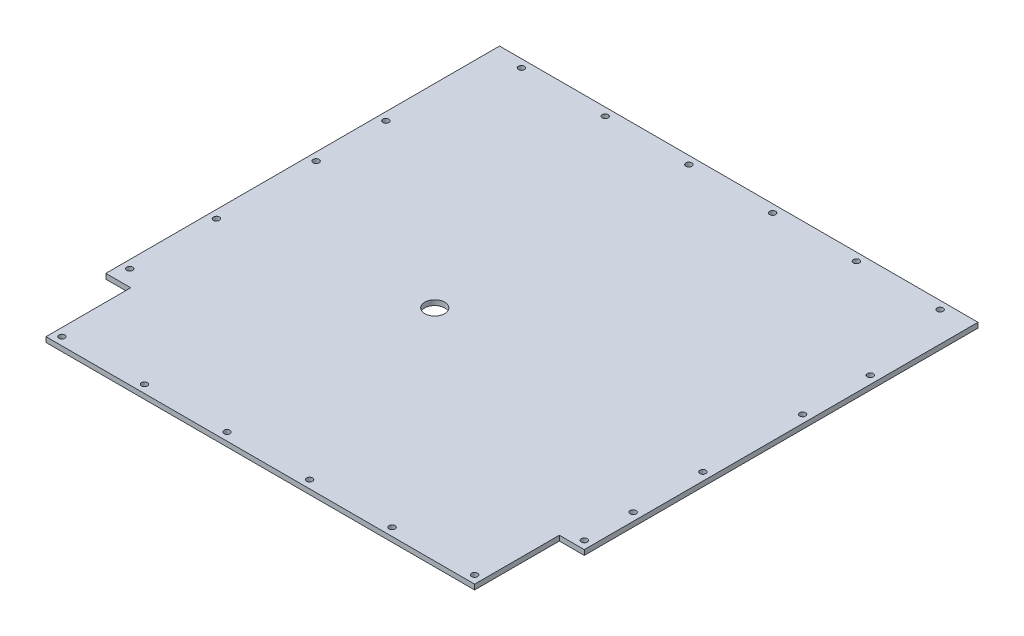
from build123d import *

# Parameters (mm, degrees)
SKETCH1_R                = 5
BOSS_EXTRUDE1_DEPTH      = 2.54
F_3_0_3_DIAMETER_HOLE1_D = 3


with BuildPart() as part:
    # Sketch1 → Boss-Extrude1 (new body)
    with BuildSketch(Plane(origin=(0, 0, 0), x_dir=(1, 0, 0), z_dir=(0, 1, 0))):
        Polygon((-107.5, -77.5), (-107.5, -120), (107.5, -120), (107.5, -77.5), (120, -77.5), (120, 120), (-120, 120), (-120, -77.5), align=None)
        with Locations(Location((-22.5, -10, 0), (0, 0, 270))):
            Circle(SKETCH1_R, mode=Mode.SUBTRACT)
    extrude(amount=BOSS_EXTRUDE1_DEPTH)

    # Ø3.0 (3) Diameter Hole1 (through all)
    with Locations(Plane.XZ):
        with Locations((-103.5, 116), (-62.1, 116), (-20.7, 116), (20.7, 116), (62.1, 116), (103.5, 116), (116, 73.5), (116, 49), (116, 14), (116, -36), (116, -70), (105, -116), (63, -116), (21, -116), (-21, -116), (-63, -116), (-105, -116), (-116, -59), (-116, -24), (-116, 26), (-116, 69.5)):
            Hole(F_3_0_3_DIAMETER_HOLE1_D / 2)


solid = part.part
